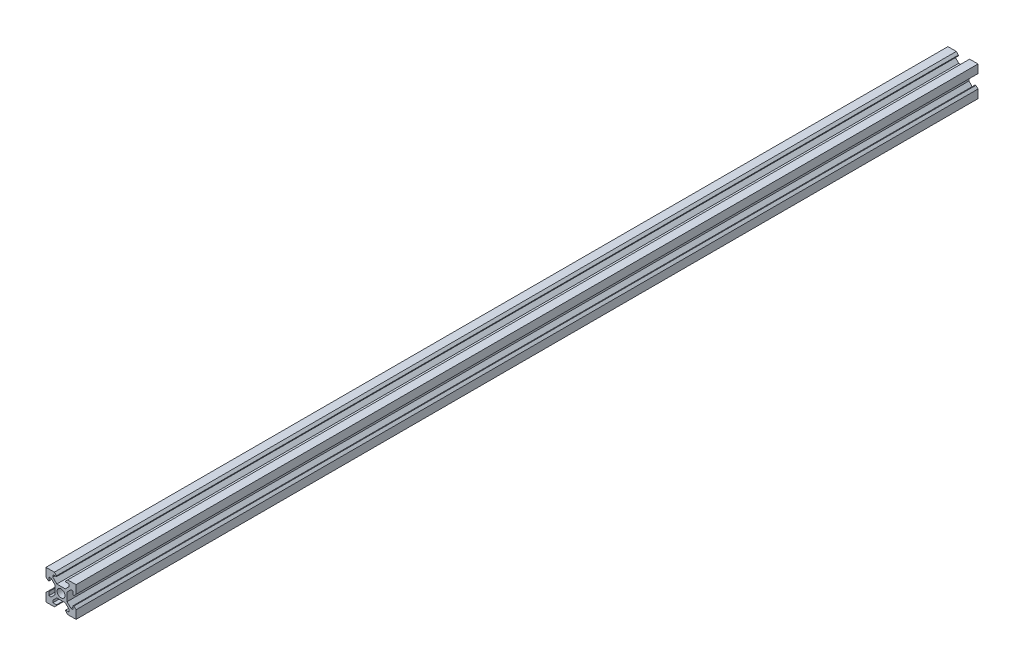
from build123d import *

# Parameters (mm, degrees)
SKETCH_2_R      = 2.6
EXTRUDE_2_DEPTH = 600


with BuildPart() as part:
    # 草图2 → 凸台-拉伸2 (new body)
    with BuildSketch(Plane.XY):
        Polygon((4.504231687, -10.088707052), (10.065653044, -10.088707052), (10.065653044, -4.527285695), (9.782810331, -4.244442983), (8.6520744, -3.113707052), (8.165653044, -3.113707052), (8.165653044, -5.488707052), (6.667734572, -5.488707052), (4.065653044, -2.886625524), (4.065653044, 2.70921142), (6.667734572, 5.311292948), (8.165653044, 5.311292948), (8.165653044, 2.936292948), (8.6520744, 2.936292948), (9.782810331, 4.06702888), (10.065653044, 4.349871592), (10.065653044, 9.911292948), (4.504231687, 9.911292948), (4.221388975, 9.628450236), (3.090653044, 8.497714305), (3.090653044, 8.011292948), (5.465653044, 8.011292948), (5.465653044, 6.513374476), (2.863571516, 3.911292948), (-2.732265428, 3.911292948), (-5.334346956, 6.513374476), (-5.334346956, 8.011292948), (-2.959346956, 8.011292948), (-2.959346956, 8.497714305), (-4.090082888, 9.628450236), (-4.3729256, 9.911292948), (-9.934346956, 9.911292948), (-9.934346956, 4.349871592), (-9.651504244, 4.06702888), (-8.520768313, 2.936292948), (-8.034346956, 2.936292948), (-8.034346956, 5.311292948), (-6.536428484, 5.311292948), (-3.934346956, 2.70921142), (-3.934346956, -2.886625524), (-6.536428484, -5.488707052), (-8.034346956, -5.488707052), (-8.034346956, -3.113707052), (-8.520768313, -3.113707052), (-9.651504244, -4.244442983), (-9.934346956, -4.527285695), (-9.934346956, -10.088707052), (-4.3729256, -10.088707052), (-4.090082888, -9.805864339), (-2.959346956, -8.675128408), (-2.959346956, -8.188707052), (-5.334346956, -8.188707052), (-5.334346956, -6.69078858), (-2.732265428, -4.088707052), (2.863571516, -4.088707052), (5.465653044, -6.69078858), (5.465653044, -8.188707052), (3.090653044, -8.188707052), (3.090653044, -8.675128408), (4.221388975, -9.805864339), align=None)
        with Locations((0.065653044, -0.088707052)):
            Circle(SKETCH_2_R, mode=Mode.SUBTRACT)
    extrude(amount=EXTRUDE_2_DEPTH)


solid = part.part
